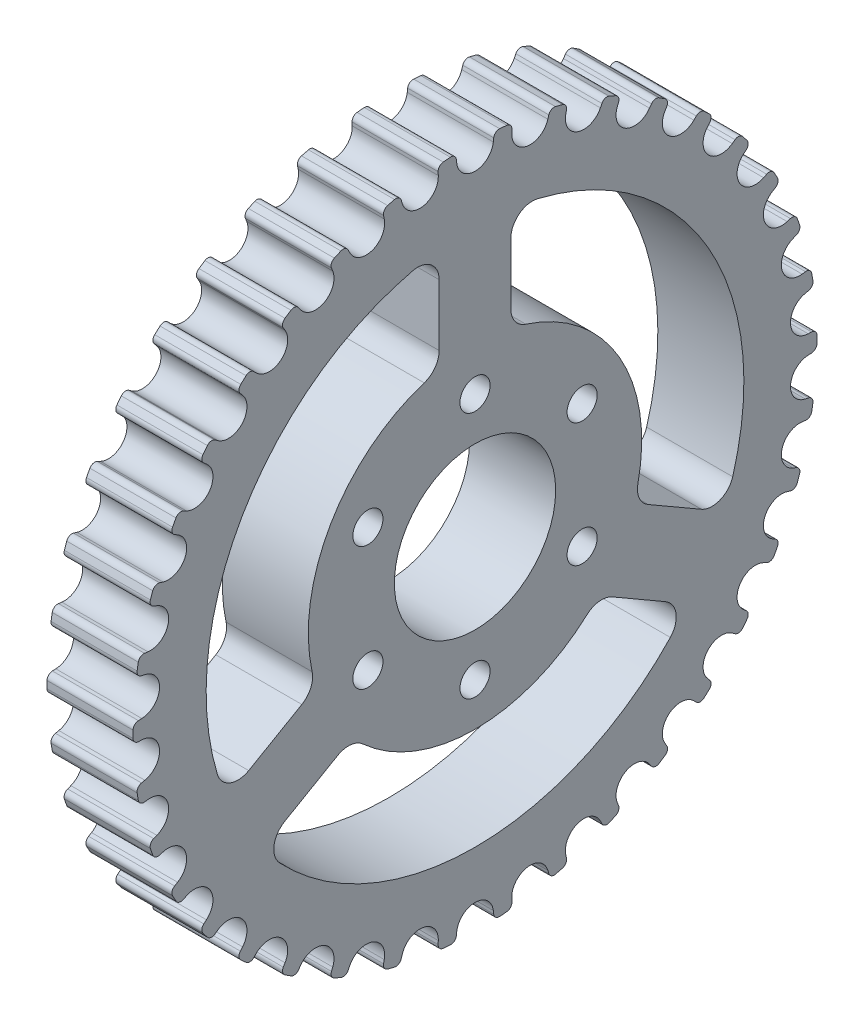
from build123d import *

# Parameters (mm, degrees)
CUT_EXTRUDE_2_REACH      = 75.037
PATTERN_CIRCULAR_3_COUNT = 38
SKETCH_8_R               = 49
CUT_EXTRUDE_4_DEPTH      = 16
SKETCH_11_R              = 11.25
SKETCH_11_R_2            = 2.1
CUT_EXTRUDE_5_DEPTH      = 20
FILLET_1_R               = 3


with BuildPart() as part:
    # 草图1 → 旋转1 (revolve)
    with BuildSketch(Plane.XY, mode=Mode.PRIVATE) as revolve_1_sk:
        Polygon((0, 0), (0, 47.699), (28, 47.699), (28, 22.1356), (20, 22.1356), (20, 0), align=None)
    revolve(revolve_1_sk.sketch.rotate(Axis((0, 0, 0), (1, 0, 0)), 90), axis=Axis((0, 0, 0), (1, 0, 0)))

    # 草图6 → 切除-拉伸2 (cut, up to next)
    with BuildSketch(Plane(origin=(0, 0, 0), x_dir=(0, 0, -1), z_dir=(1, 0, 0)), mode=Mode.PRIVATE) as cut_extrude_2_sk1:
        with BuildLine():
            Line((2.609302062, 46.891901673), (2.55084361, 46.415795787))
            ThreePointArc((2.55084361, 46.415795787), (0, 44.159), (-2.55084361, 46.415795787))
            Line((-2.55084361, 46.415795787), (-2.609302062, 46.891901673))
            ThreePointArc((-2.609302062, 46.891901673), (-2.88805846, 47.399296498), (-3.439736503, 47.574812809))
            ThreePointArc((-3.439736503, 47.574812809), (-3.828606137, 47.545098339), (-4.217219819, 47.512205358))
            Line((-4.217219819, 47.512205358), (-4.413867808, 49.1137747))
            ThreePointArc((-4.413867808, 49.1137747), (0, 49.311713561), (4.413867808, 49.1137747))
            Line((4.413867808, 49.1137747), (4.217219819, 47.512205358))
            ThreePointArc((4.217219819, 47.512205358), (3.828606137, 47.545098339), (3.439736503, 47.574812809))
            ThreePointArc((3.439736503, 47.574812809), (2.88805846, 47.399296498), (2.609302062, 46.891901673))
        make_face()
    cut_extrude_2_tool1 = extrude(cut_extrude_2_sk1.sketch, amount=CUT_EXTRUDE_2_REACH, mode=Mode.PRIVATE) & part.part
    cut_extrude_2 = cut_extrude_2_tool1.solids().sort_by_distance((0, 47.242726, 0))[0]
    add(cut_extrude_2, mode=Mode.SUBTRACT)

    # 阵列(圆周)3: 切除-拉伸2 ×38 about axis
    pattern_circular_3_axis = Axis((0, 0, 0), (1, 0, 0))
    for i in range(1, PATTERN_CIRCULAR_3_COUNT):
        add(cut_extrude_2.rotate(pattern_circular_3_axis, i * 360 / PATTERN_CIRCULAR_3_COUNT), mode=Mode.SUBTRACT)

    # 草图8 → 切除-拉伸4 (cut)
    with BuildSketch(Plane(origin=(28, 0, 0), x_dir=(0, 0, -1), z_dir=(1, 0, 0))):
        Circle(SKETCH_8_R)
    extrude(amount=-CUT_EXTRUDE_4_DEPTH, mode=Mode.SUBTRACT)

    # 草图11 → 切除-拉伸5 (cut)
    with BuildSketch(Plane(origin=(12, 0, 0), x_dir=(0, 0, -1), z_dir=(1, 0, 0))):
        Circle(SKETCH_11_R)
        with BuildLine():
            ThreePointArc((-22.163974039, -7.022873686), (-20.135090638, 11.625), (-5, 22.706001409))
            Line((-5, 22.706001409), (-5, 37.165171868))
            ThreePointArc((-5, 37.165171868), (-32.475952642, 18.75), (-34.685982974, -14.252458915))
            Line((-34.685982974, -14.252458915), (-22.163974039, -7.022873686))
        make_face()
        with BuildLine():
            Line((5, 37.165171868), (5, 22.706001409))
            ThreePointArc((5, 22.706001409), (18.121982507, 14.565584437), (23.25, 0))
            ThreePointArc((23.25, 0), (22.976889437, -3.55317489), (22.163974039, -7.022873686))
            Line((22.163974039, -7.022873686), (34.685982974, -14.252458915))
            ThreePointArc((34.685982974, -14.252458915), (36.789770056, -7.263801982), (37.5, 0))
            ThreePointArc((37.5, 0), (28.228974477, 24.685522073), (5, 37.165171868))
        make_face()
        with BuildLine():
            Line((29.685982974, -22.912712953), (17.163974039, -15.683127724))
            ThreePointArc((17.163974039, -15.683127724), (0, -23.25), (-17.163974039, -15.683127724))
            Line((-17.163974039, -15.683127724), (-29.685982974, -22.912712953))
            ThreePointArc((-29.685982974, -22.912712953), (0, -37.5), (29.685982974, -22.912712953))
        make_face()
        with Locations((0, 17.25)):
            Circle(SKETCH_11_R_2)
        with Locations((-14.938938215, 8.625)):
            Circle(SKETCH_11_R_2)
        with Locations((-14.938938215, -8.625)):
            Circle(SKETCH_11_R_2)
        with Locations((14.938938215, 8.625)):
            Circle(SKETCH_11_R_2)
        with Locations((14.938938215, -8.625)):
            Circle(SKETCH_11_R_2)
        with Locations((0, -17.25)):
            Circle(SKETCH_11_R_2)
    extrude(amount=-CUT_EXTRUDE_5_DEPTH, mode=Mode.SUBTRACT)

    # 圆角1
    fillet_1_edges = [part.edges().sort_by_distance(p)[0] for p in [
        (6, 37.165171868, 5),
        (6, 22.706001409, 5),
        (6, -7.022873686, 22.163974039),
        (6, -14.252458915, 34.685982974),
        (6, -14.252458915, -34.685982974),
        (6, -7.022873686, -22.163974039),
        (6, 22.706001409, -5),
        (6, 37.165171868, -5),
        (6, -22.912712953, 29.685982974),
        (6, -15.683127724, 17.163974039),
        (6, -15.683127724, -17.163974039),
        (6, -22.912712953, -29.685982974),
    ]]
    fillet(fillet_1_edges, radius=FILLET_1_R)


solid = part.part
